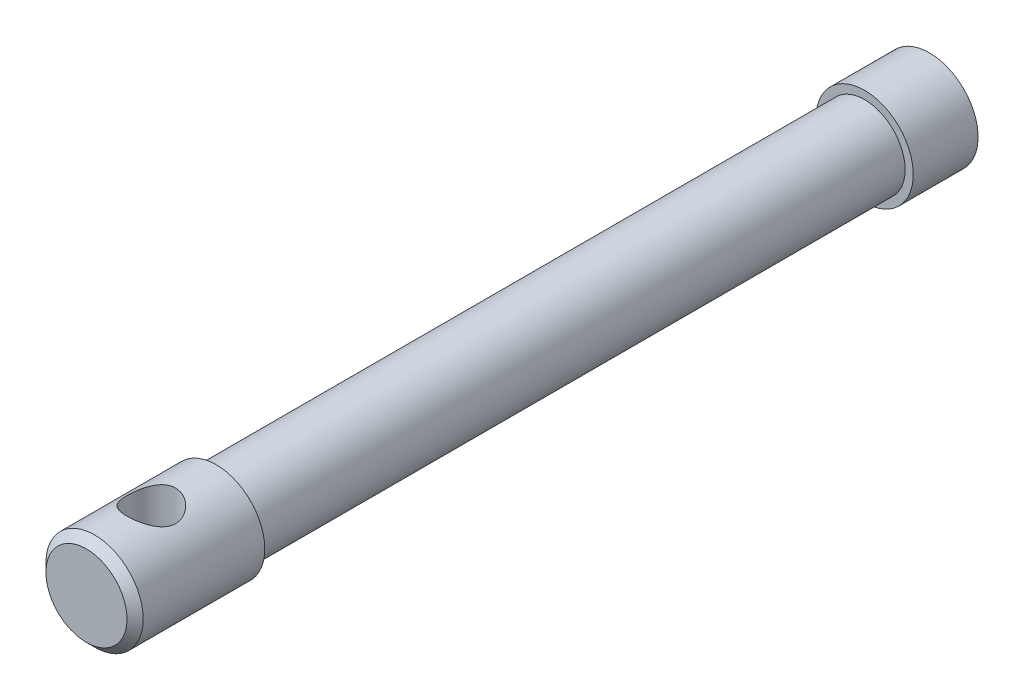
from build123d import *

# Parameters (mm, degrees)
SKETCH1_R               = 7.9375
BOSS_EXTRUDE1_DEPTH     = 165.1
SKETCH2_R               = 9.525
BOSS_EXTRUDE2_DEPTH     = 25.4
CHAMFER2_SIZE           = 1.5875
CUT_EXTRUDE2_DEPTH      = 39.878
CUT_EXTRUDE2_DEPTH_BACK = 41.148
SKETCH3_R               = 4.7625
BOSS_EXTRUDE3_START     = -12.7
SKETCH4_R               = 9.525
BOSS_EXTRUDE3_DEPTH     = 12.7


with BuildPart() as part:
    # Sketch1 → Boss-Extrude1 (new body)
    with BuildSketch(Plane.XY):
        Circle(SKETCH1_R)
    extrude(amount=-BOSS_EXTRUDE1_DEPTH)

    # Sketch2 → Boss-Extrude2 (add)
    with BuildSketch(Plane.XY):
        Circle(SKETCH2_R)
    extrude(amount=-BOSS_EXTRUDE2_DEPTH)

    # Chamfer2
    chamfer2_edges = [part.edges().sort_by_distance(p)[0] for p in [
        (-9.525, 0, 0),
    ]]
    chamfer(chamfer2_edges, length=CHAMFER2_SIZE)

    # Sketch3 → Cut-Extrude2 (cut, two sides: drawn at the far end of the back side and taken through both)
    with BuildSketch(Plane(origin=(0, 0, 0), x_dir=(1, 0, 0), z_dir=(0, 1, 0)).offset(-CUT_EXTRUDE2_DEPTH_BACK)):
        with Locations(Location((0, 12.7, 0), (0, 0, 90))):
            Circle(SKETCH3_R)
    extrude(amount=CUT_EXTRUDE2_DEPTH + CUT_EXTRUDE2_DEPTH_BACK, mode=Mode.SUBTRACT)

    # Sketch4 → Boss-Extrude3 (add)
    with BuildSketch(Plane(origin=(0, 0, -165.1), x_dir=(-1, 0, 0), z_dir=(0, 0, -1)).offset(BOSS_EXTRUDE3_START)):
        with Locations(Location((0, 0, 0), (0, 0, 180))):
            Circle(SKETCH4_R)
    extrude(amount=BOSS_EXTRUDE3_DEPTH)


solid = part.part
